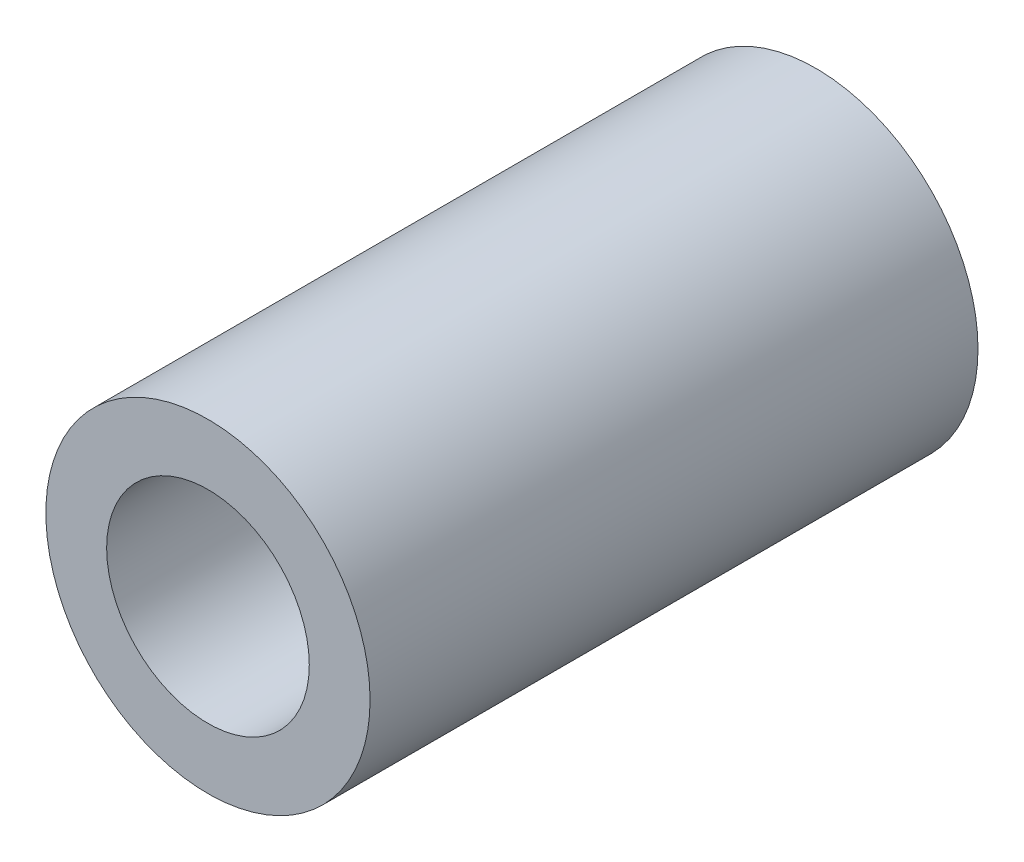
from build123d import *

# Parameters (mm, degrees)
SKETCH_1_R      = 1.6
SKETCH_1_R_2    = 1
EXTRUDE_1_DEPTH = 6


with BuildPart() as part:
    # 草图1 → 凸台-拉伸1 (new body)
    with BuildSketch(Plane.XY):
        Circle(SKETCH_1_R)
        Circle(SKETCH_1_R_2, mode=Mode.SUBTRACT)
    extrude(amount=EXTRUDE_1_DEPTH)


solid = part.part
